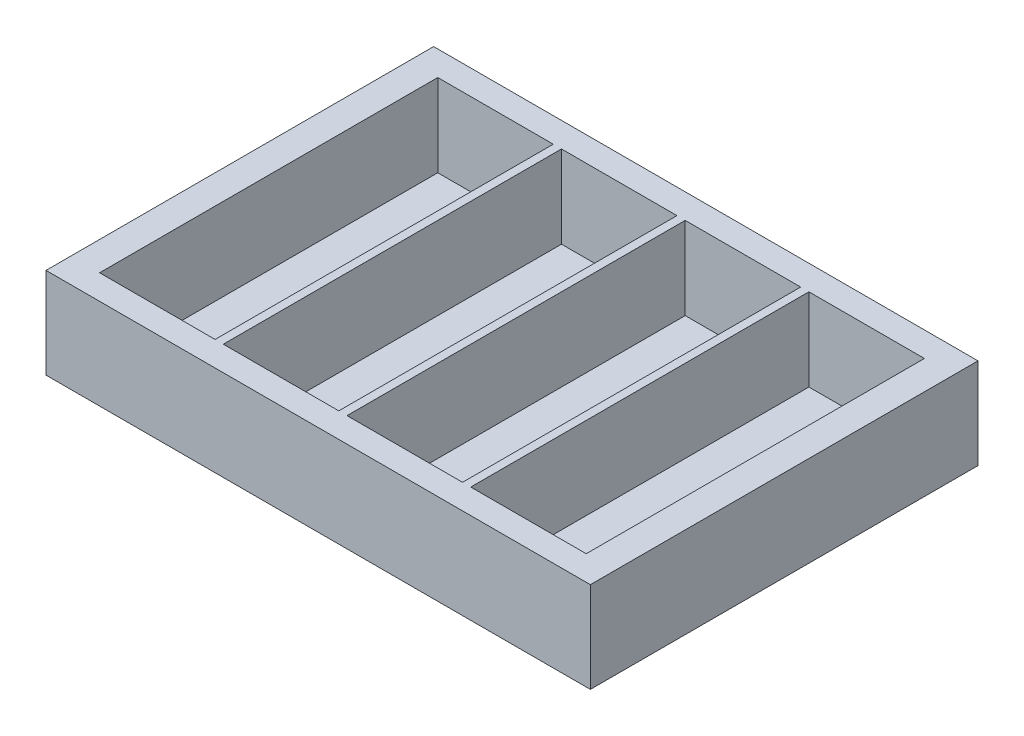
from build123d import *

# Parameters (mm, degrees)
SKETCH1_W           = 66
SKETCH1_H           = 47
SKETCH1_W_2         = 59
SKETCH1_H_2         = 41
BOSS_EXTRUDE1_DEPTH = 10
SKETCH3_W           = 66
SKETCH3_H           = 47
BOSS_EXTRUDE2_DEPTH = 1
SKETCH6_W           = 1
SKETCH6_H           = 41
SKETCH6_W_2         = 0.5
BOSS_EXTRUDE3_DEPTH = 10


with BuildPart() as part:
    # Sketch1 → Boss-Extrude1 (new body)
    with BuildSketch(Plane(origin=(0, 0, 0), x_dir=(1, 0, 0), z_dir=(0, 1, 0))):
        Rectangle(SKETCH1_W, SKETCH1_H)
        Rectangle(SKETCH1_W_2, SKETCH1_H_2, mode=Mode.SUBTRACT)
    extrude(amount=BOSS_EXTRUDE1_DEPTH)

    # Sketch3 → Boss-Extrude2 (add)
    with BuildSketch(Plane(origin=(0, 0, 0), x_dir=(-1, 0, 0), z_dir=(0, -1, 0))):
        Rectangle(SKETCH3_W, SKETCH3_H)
    extrude(amount=BOSS_EXTRUDE2_DEPTH)

    # Sketch6 → Boss-Extrude3 (add)
    with BuildSketch(Plane(origin=(0, 10, 0), x_dir=(1, 0, 0), z_dir=(0, 1, 0))):
        with Locations((-15, 0)):
            Rectangle(SKETCH6_W, SKETCH6_H)
        with Locations((-0.25, 0)):
            Rectangle(SKETCH6_W_2, SKETCH6_H)
        with Locations((0.25, 0)):
            Rectangle(SKETCH6_W_2, SKETCH6_H)
        with Locations((15, 0)):
            Rectangle(SKETCH6_W, SKETCH6_H)
    extrude(amount=-BOSS_EXTRUDE3_DEPTH)


solid = part.part
